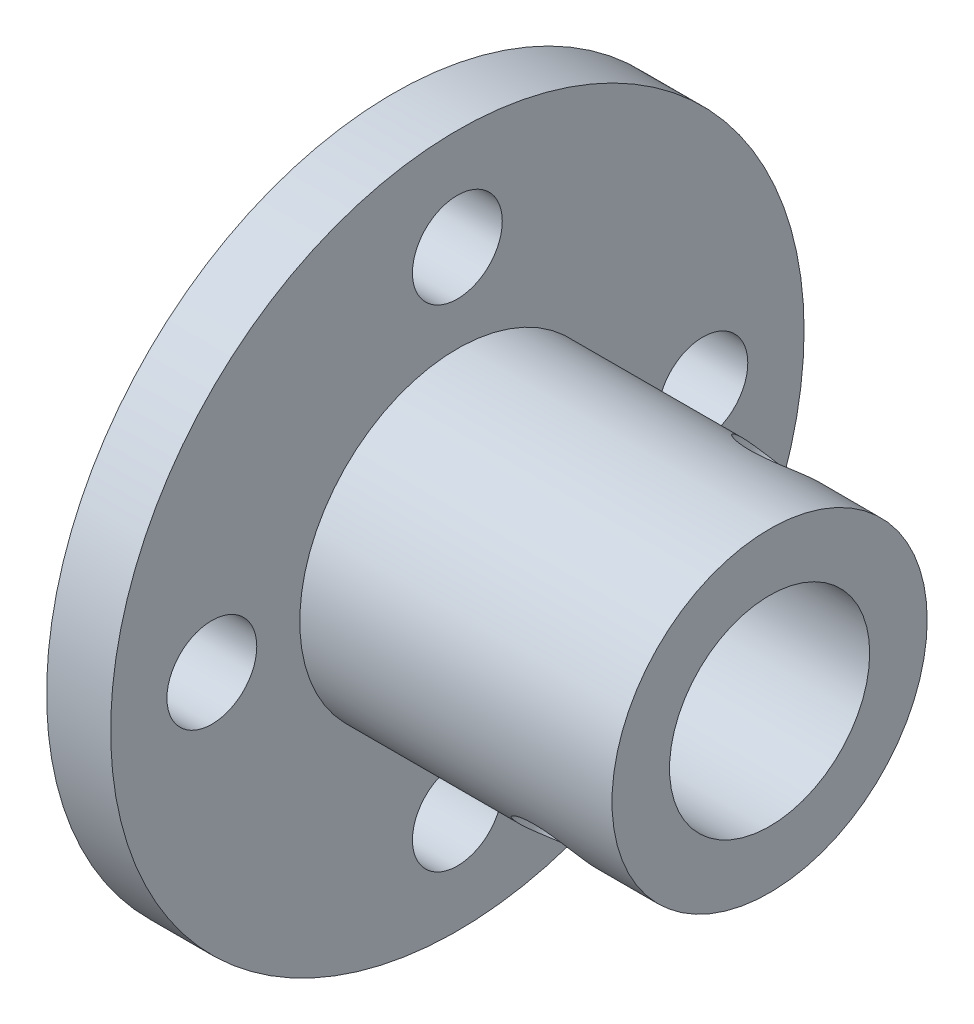
from build123d import *

# Parameters (mm, degrees)
PIN_CUT_DEPTH      = 20.609075552
PIN_CUT_DEPTH_BACK = 20.609075552
SKETCH3_R          = 1.2446
SKETCH2_R          = 1.425
CUT_EXTRUDE2_DEPTH = 20.609075613


with BuildPart() as part:
    # Sketch1 → Revolve1 (revolve)
    with BuildSketch(Plane.XY):
        Polygon((0, 3.175), (0, 5), (-9.906, 5), (-9.906, 11), (-11.938, 11), (-11.938, 3.175), align=None)
    revolve(axis=Axis((0, 0, 0), (-1, 0, 0)))

    # Sketch3 → Pin Cut (cut, two sides: drawn at the far end of the back side and taken through both)
    with BuildSketch(Plane(origin=(0, 0, 0), x_dir=(1, 0, 0), z_dir=(0, 0.7071067811865464, -0.7071067811865488)).offset(-PIN_CUT_DEPTH_BACK)):
        with Locations((-3.175, 0)):
            Circle(SKETCH3_R)
    extrude(amount=PIN_CUT_DEPTH + PIN_CUT_DEPTH_BACK, mode=Mode.SUBTRACT)

    # Sketch2 → Cut-Extrude2 (cut, through all)
    with BuildSketch(Plane.ZY.offset(11.938)):
        with Locations((-7.78885, 0)):
            Circle(SKETCH2_R)
        with Locations((0, 7.78885)):
            Circle(SKETCH2_R)
        with Locations((7.78885, 0)):
            Circle(SKETCH2_R)
        with Locations((0, -7.78885)):
            Circle(SKETCH2_R)
    extrude(amount=-CUT_EXTRUDE2_DEPTH, mode=Mode.SUBTRACT)


solid = part.part
